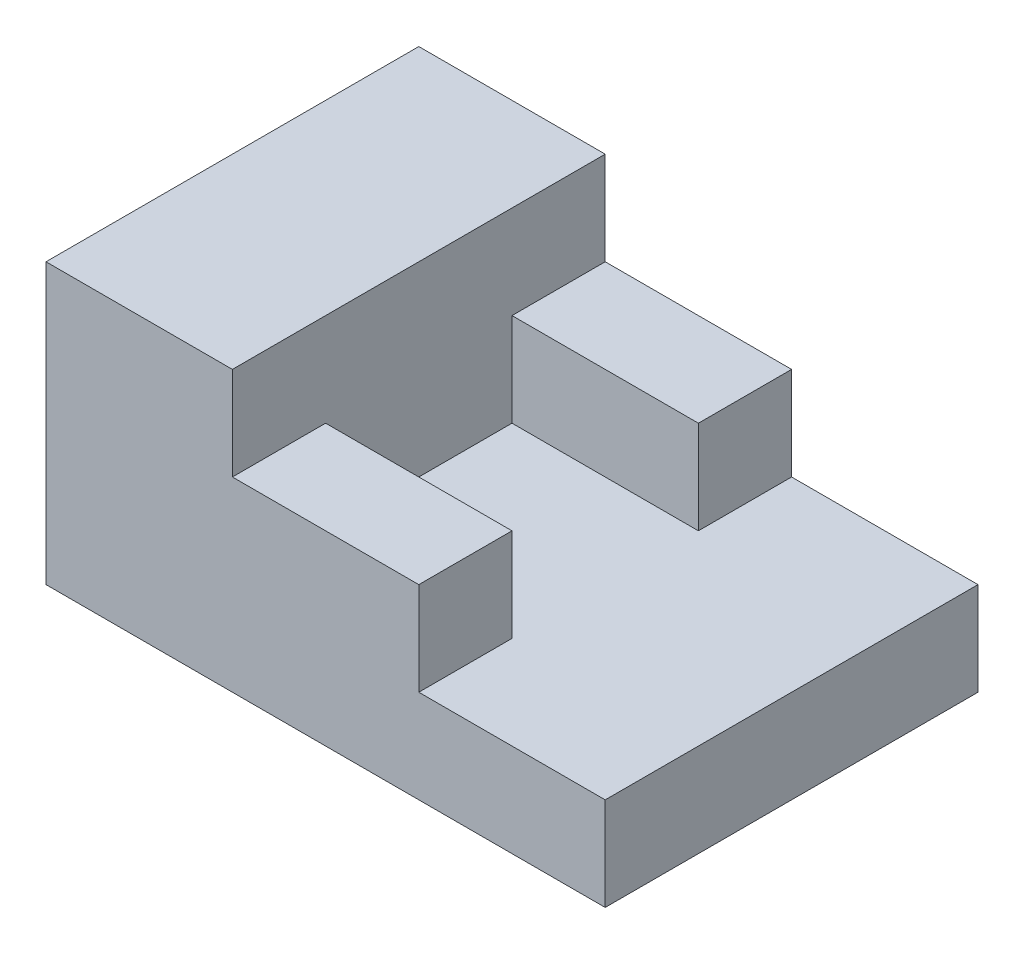
from build123d import *

# Parameters (mm, degrees)
EXTRUDE_1_DEPTH     = 40
CUT_EXTRUDE_1_DEPTH = 10


with BuildPart() as part:
    # 草圖1 → 填料-伸長1 (new body)
    with BuildSketch(Plane.XY):
        Polygon((0, 0), (0, 10), (-20, 10), (-20, -20), (40, -20), (40, -10), (20, -10), (20, 0), align=None)
    extrude(amount=EXTRUDE_1_DEPTH)

    # 草圖2 → 除料-伸長1 (cut)
    with BuildSketch(Plane(origin=(0, 0, 0), x_dir=(1, 0, 0), z_dir=(0, 1, 0))):
        Polygon((0, -10), (20, -10), (20, 0), (40, 0), (40, -40), (20, -40), (20, -30), (0, -30), align=None)
    extrude(amount=-CUT_EXTRUDE_1_DEPTH, mode=Mode.SUBTRACT)


solid = part.part
